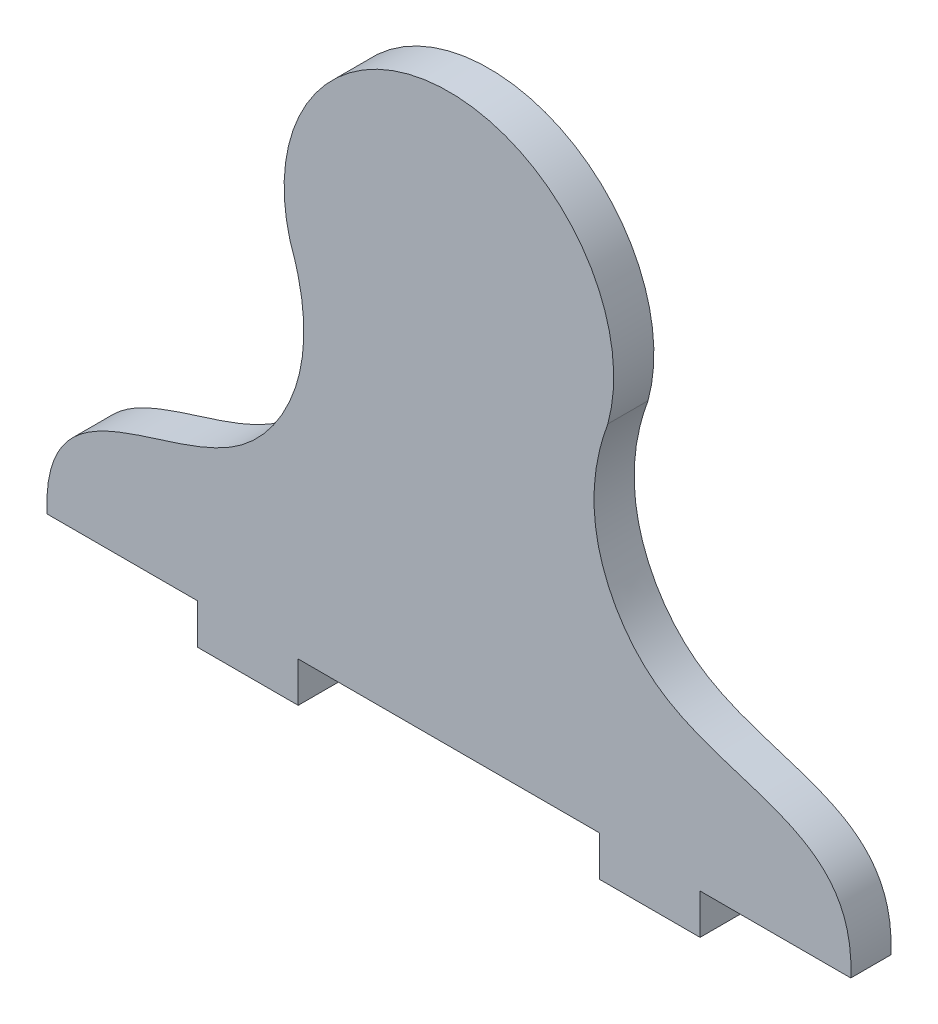
from build123d import *

# Parameters (mm, degrees)
BOSS_EXTRUDE1_DEPTH = 4


with BuildPart() as part:
    # Sketch1 → Boss-Extrude1 (new body)
    with BuildSketch(Plane.XY):
        with BuildLine():
            ThreePointArc((55.819281992, 35.66920927), (53.03910268, 49.949232755), (40, 56.401385036))
            Line((40, 56.401385036), (40, 0))
            Line((40, 0), (55, 0))
            Line((55, 0), (55, -4))
            Line((55, -4), (65, -4))
            Line((65, -4), (65, 0))
            Line((65, 0), (80, 0))
            add(Edge.make_bspline(
                [(80, 0), (80.558151579, 12.429856436), (63.082498357, 9.400795532), (53.987736886, 23.874928316), (54.293563423, 30.674851608), (55.257577446, 33.982379076)],
                knots=[0, 0, 0, 0, 0.197688336, 0.274980814, 0.348282071, 0.348282071, 0.348282071, 0.348282071], degree=3))
            add(Edge.make_bspline(
                [(55.257577446, 33.982379076), (55.421541003, 34.544937251), (55.609085838, 35.107428191), (55.819281992, 35.66920927)],
                knots=[0.348282071, 0.348282071, 0.348282071, 0.348282071, 0.360749457, 0.360749457, 0.360749457, 0.360749457], degree=3))
        make_face()
        with BuildLine():
            add(Edge.make_bspline(
                [(0, 0), (-0.558151579, 12.429856436), (16.917501643, 9.400795532), (26.012263114, 23.874928316), (25.706436577, 30.674851608), (24.742422554, 33.982379076)],
                knots=[0, 0, 0, 0, 0.197688336, 0.274980814, 0.348282071, 0.348282071, 0.348282071, 0.348282071], degree=3))
            Line((0, 0), (15, 0))
            Line((15, 0), (15, -4))
            Line((15, -4), (25, -4))
            Line((25, -4), (25, 0))
            Line((25, 0), (40, 0))
            Line((40, 0), (40, 56.401385036))
            ThreePointArc((40, 56.401385036), (26.96089732, 49.949232755), (24.180718008, 35.66920927))
            add(Edge.make_bspline(
                [(24.742422554, 33.982379076), (24.578458997, 34.544937251), (24.390914162, 35.107428191), (24.180718008, 35.66920927)],
                knots=[0.348282071, 0.348282071, 0.348282071, 0.348282071, 0.360749457, 0.360749457, 0.360749457, 0.360749457], degree=3))
        make_face()
    extrude(amount=BOSS_EXTRUDE1_DEPTH)


solid = part.part
